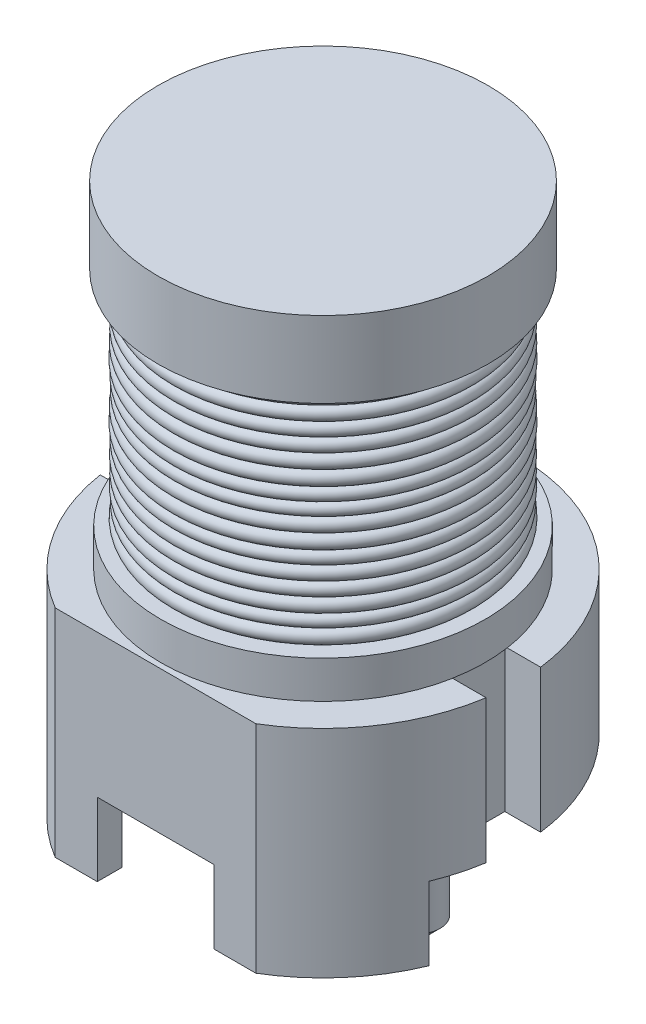
from build123d import *

# Parameters (mm, degrees)
ENL_V_MAT_EXTRU_1_DEPTH = 3
ESQUISSE3_R             = 1.027444169
ESQUISSE3_R_2           = 0.956407515
BOSS_EXTRU_1_DEPTH      = 5
ENL_V_MAT_EXTRU_2_DEPTH = 23.676373315
CHANFREIN1_SIZE         = 0.5
ENL_V_MAT_EXTRU_3_DEPTH = 5.865


with BuildPart() as part:
    # Esquisse1 → Révolution1 (revolve)
    with BuildSketch(Plane.XY):
        with BuildLine():
            Line((0, 27.288195958), (6.768471494, 27.288195958))
            Line((6.768471494, 27.288195958), (6.768471494, 24.163831824))
            Line((6.768471494, 24.163831824), (5.907777493, 24.163831824))
            ThreePointArc((5.907777493, 24.163831824), (6.207777493, 23.863831824), (5.907777493, 23.563831824))
            ThreePointArc((5.907777493, 23.563831824), (6.197776871, 23.273832445), (5.907777493, 22.983833067))
            ThreePointArc((5.907777493, 22.983833067), (6.186936489, 22.704674071), (5.907777493, 22.425515075))
            ThreePointArc((5.907777493, 22.425515075), (6.188746488, 22.14454608), (5.907777493, 21.863577084))
            ThreePointArc((5.907777493, 21.863577084), (6.200316512, 21.571038065), (5.907777493, 21.278499046))
            ThreePointArc((5.907777493, 21.278499046), (6.210259875, 20.976016664), (5.907777493, 20.673534282))
            ThreePointArc((5.907777493, 20.673534282), (6.181305497, 20.400006277), (5.907777493, 20.126478273))
            ThreePointArc((5.907777493, 20.126478273), (6.170224739, 19.864031027), (5.907777493, 19.601583781))
            ThreePointArc((5.907777493, 19.601583781), (6.196512861, 19.312848413), (5.907777493, 19.024113045))
            ThreePointArc((5.907777493, 19.024113045), (6.208396203, 18.723494336), (5.907777493, 18.422875626))
            ThreePointArc((5.907777493, 18.422875626), (6.178873307, 18.151779812), (5.907777493, 17.880683998))
            ThreePointArc((5.907777493, 17.880683998), (6.192891572, 17.595569919), (5.907777493, 17.31045584))
            ThreePointArc((5.907777493, 17.31045584), (6.188339665, 17.029893667), (5.907777493, 16.749331495))
            ThreePointArc((5.907777493, 16.749331495), (6.197496946, 16.459612042), (5.907777493, 16.169892589))
            ThreePointArc((5.907777493, 16.169892589), (6.170986561, 15.90668352), (5.907777493, 15.643474451))
            ThreePointArc((5.907777493, 15.643474451), (6.204185943, 15.347066001), (5.907777493, 15.05065755))
            Line((5.907777493, 15.05065755), (5.907777493, 15.039335738))
            Line((5.907777493, 15.039335738), (6.649770026, 15.039335738))
            Line((6.649770026, 15.039335738), (6.649770026, 13.501109146))
            Line((6.649770026, 13.501109146), (7.086367087, 13.501109146))
            Line((7.086367087, 13.501109146), (8.005961063, 13.501109146))
            Line((8.005961063, 13.501109146), (8.005961063, 7.646126319))
            Line((8.005961063, 7.646126319), (8.005961063, 4.640624056))
            Line((8.005961063, 4.640624056), (0, 4.640624056))
            Line((0, 4.640624056), (0, 27.288195958))
        make_face()
    revolve(axis=Axis((0, 27.288195958, 0), (0, -1, 0)))

    # Esquisse2 → Enlèv. mat.-Extru.1 (cut)
    with BuildSketch(Plane.XZ.offset(-4.640624056)):
        with BuildLine():
            Line((2.387977199, 6.868377332), (4.113490655, 6.868377332))
            ThreePointArc((4.113490655, 6.868377332), (0, 8.005961063), (-4.113490655, 6.868377332))
            Line((-4.113490655, 6.868377332), (-2.387977199, 6.868377332))
            Line((-2.387977199, 6.868377332), (-2.387977199, 5.860596536))
            ThreePointArc((-2.387977199, 5.860596536), (-4.048371275, 4.712685794), (-5.209560781, 3.061550885))
            Line((-5.209560781, 3.061550885), (-7.397453529, 3.061550885))
            ThreePointArc((-7.397453529, 3.061550885), (-7.251044586, -3.39378328), (-2.387977199, -7.641529784))
            Line((-2.387977199, -7.641529784), (-2.387977199, -5.245608804))
            ThreePointArc((-2.387977199, -5.245608804), (-1.229023712, -5.679027316), (0, -5.822294564))
            ThreePointArc((0, -5.822294564), (1.229023712, -5.679027316), (2.387977199, -5.245608804))
            Line((2.387977199, -5.245608804), (2.387977199, -7.641529784))
            ThreePointArc((2.387977199, -7.641529784), (7.251044586, -3.39378328), (7.397453529, 3.061550885))
            Line((7.397453529, 3.061550885), (5.209560781, 3.061550885))
            ThreePointArc((5.209560781, 3.061550885), (4.048371275, 4.712685794), (2.387977199, 5.860596536))
            Line((2.387977199, 5.860596536), (2.387977199, 6.868377332))
        make_face()
    extrude(amount=-ENL_V_MAT_EXTRU_1_DEPTH, mode=Mode.SUBTRACT)

    # Esquisse3 → Boss.-Extru.1 (add)
    with BuildSketch(Plane.XZ.offset(-7.640624056)):
        with Locations((-3.71558161, 0)):
            Circle(ESQUISSE3_R)
        with Locations((3.844819232, 0)):
            Circle(ESQUISSE3_R_2)
    extrude(amount=BOSS_EXTRU_1_DEPTH)

    # Esquisse4 → Enlèv. mat.-Extru.2 (cut, through all)
    with BuildSketch(Plane.XZ.offset(-7.640624056)):
        with BuildLine():
            Line((-4.113490655, 6.868377332), (4.113490655, 6.868377332))
            ThreePointArc((4.113490655, 6.868377332), (0, 8.005961063), (-4.113490655, 6.868377332))
        make_face()
    extrude(amount=-ENL_V_MAT_EXTRU_2_DEPTH, mode=Mode.SUBTRACT)

    # Chanfrein1
    chanfrein1_edges = [part.edges().sort_by_distance(p)[0] for p in [
        (-4.743025779, 2.640624056, 0),
        (2.888411717, 2.640624056, 0),
    ]]
    chamfer(chanfrein1_edges, length=CHANFREIN1_SIZE)

    # Esquisse5 → Enlèv. mat.-Extru.3 (cut)
    with BuildSketch(Plane.XZ.offset(-7.640624056)):
        with BuildLine():
            Line((7.91175133, 1.224582962), (6.477157492, 1.224582962))
            Line((6.477157492, 1.224582962), (6.477157492, -0.976465558))
            Line((6.477157492, -0.976465558), (7.946189499, -0.976465558))
            ThreePointArc((7.946189499, -0.976465558), (8.004981292, 0.125247987), (7.91175133, 1.224582962))
        make_face()
        with BuildLine():
            Line((-6.477157492, -0.976465558), (-7.946189499, -0.976465558))
            ThreePointArc((-7.946189499, -0.976465558), (-8.004981292, 0.125247987), (-7.91175133, 1.224582962))
            Line((-7.91175133, 1.224582962), (-6.477157492, 1.224582962))
            Line((-6.477157492, 1.224582962), (-6.477157492, -0.976465558))
        make_face()
    extrude(amount=-ENL_V_MAT_EXTRU_3_DEPTH, mode=Mode.SUBTRACT)


solid = part.part
